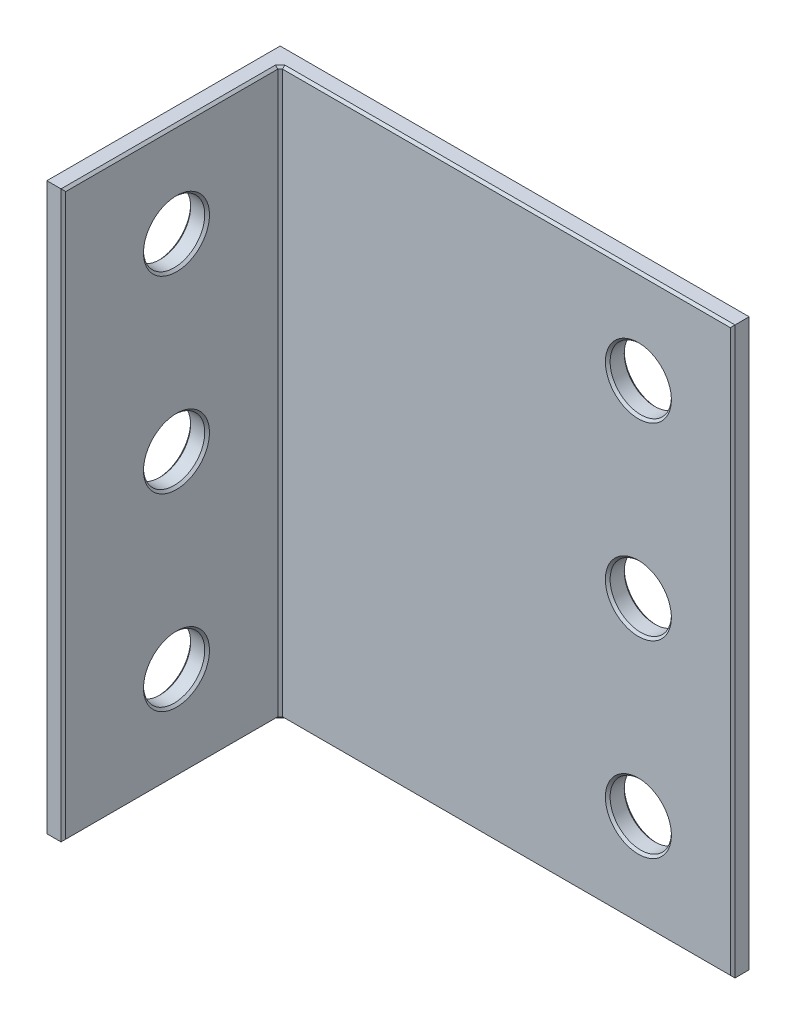
from build123d import *

# Parameters (mm, degrees)
SKETCH_1_W          = 200
SKETCH_1_H          = 240
SKETCH_1_R          = 13
EXTRUDE_323_DEPTH   = 8
SKETCH_2_W          = 8
SKETCH_2_H          = 240
EXTRUDE_1_DEPTH     = 92
SKETCH_3_R          = 13
CUT_EXTRUDE_1_DEPTH = 329.024389337
CHAMFER_1_SIZE      = 1


with BuildPart() as part:
    # 草图1 → Extrude 323 (new body)
    with BuildSketch(Plane.XY):
        with Locations((100, 120)):
            Rectangle(SKETCH_1_W, SKETCH_1_H)
        with Locations((160, 40)):
            Circle(SKETCH_1_R, mode=Mode.SUBTRACT)
        with Locations((160, 120)):
            Circle(SKETCH_1_R, mode=Mode.SUBTRACT)
        with Locations((160, 200)):
            Circle(SKETCH_1_R, mode=Mode.SUBTRACT)
    extrude(amount=EXTRUDE_323_DEPTH)

    # 草图2 → 凸台-拉伸1 (add)
    with BuildSketch(Plane.XY.offset(8)):
        with Locations((4, 120)):
            Rectangle(SKETCH_2_W, SKETCH_2_H)
    extrude(amount=EXTRUDE_1_DEPTH)

    # 草图3 → 切除-拉伸1 (cut, through all)
    with BuildSketch(Plane.ZY):
        with Locations((52, 200)):
            Circle(SKETCH_3_R)
        with Locations((52, 120)):
            Circle(SKETCH_3_R)
        with Locations((52, 40)):
            Circle(SKETCH_3_R)
    extrude(amount=-CUT_EXTRUDE_1_DEPTH, mode=Mode.SUBTRACT)

    # 倒角1
    chamfer_1_edges = [part.edges().sort_by_distance(p)[0] for p in [
        (200, 120, 8),
        (147, 40, 0),
        (147, 40, 8),
        (104, 240, 8),
        (147, 120, 0),
        (147, 120, 8),
        (147, 200, 0),
        (147, 200, 8),
        (104, 0, 8),
        (8, 120, 8),
        (8, 0, 54),
        (8, 240, 54),
        (0, 120, 100),
        (8, 120, 100),
        (8, 200, 39),
        (0, 200, 39),
        (100, 240, 0),
        (8, 120, 39),
        (0, 120, 39),
        (8, 40, 39),
        (0, 40, 39),
        (200, 120, 0),
        (100, 0, 0),
        (0, 120, 0),
        (0, 240, 50),
        (0, 0, 50),
    ]]
    chamfer(chamfer_1_edges, length=CHAMFER_1_SIZE)


solid = part.part
